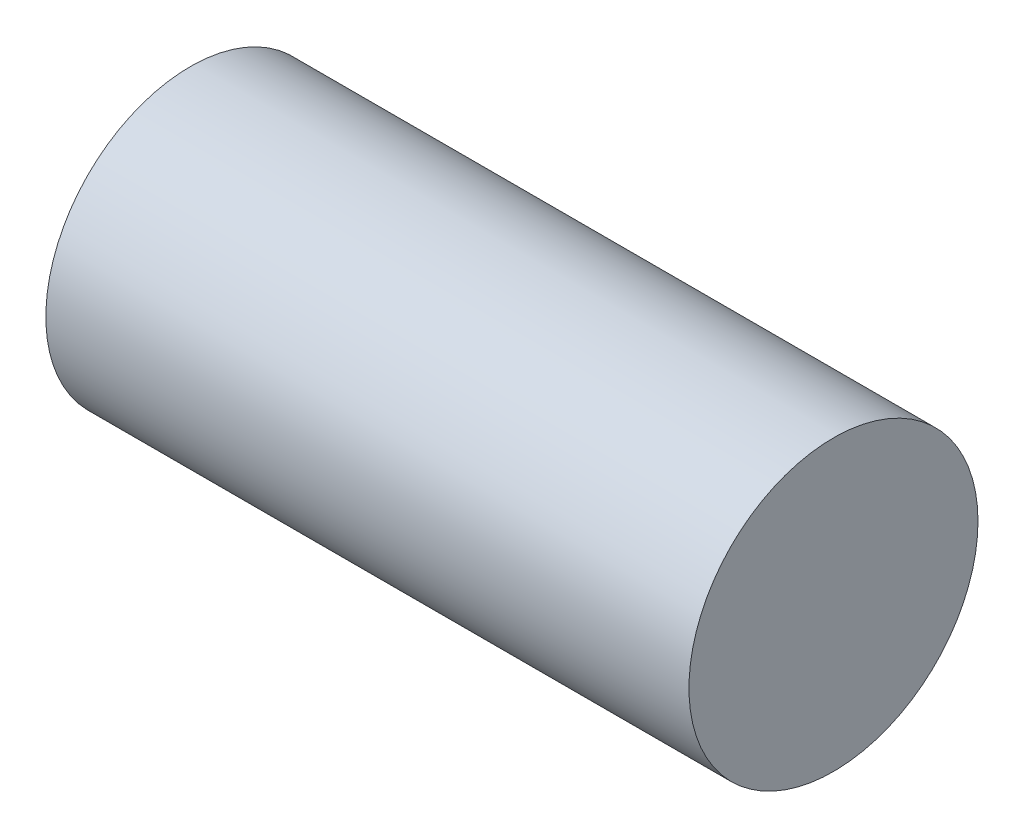
from build123d import *

# Parameters (mm, degrees)
SKETCH_1_R      = 20
EXTRUDE_1_DEPTH = 89


with BuildPart() as part:
    # 草图1 → 凸台-拉伸1 (new body)
    with BuildSketch(Plane(origin=(0, 0, 0), x_dir=(0, 0, -1), z_dir=(1, 0, 0))):
        Circle(SKETCH_1_R)
    extrude(amount=EXTRUDE_1_DEPTH)


solid = part.part
